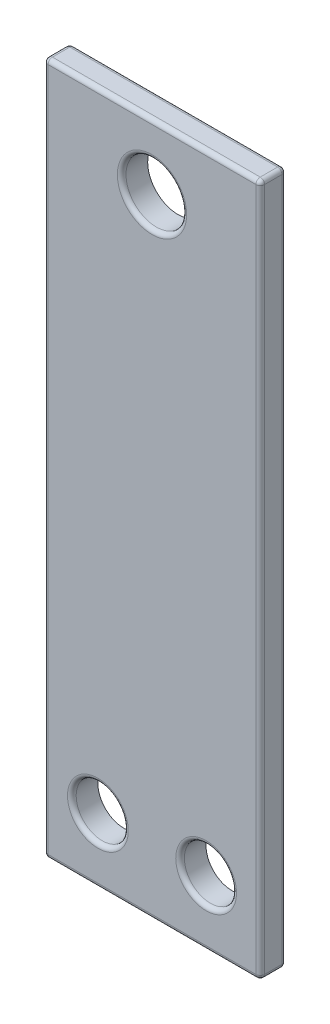
from build123d import *

# Parameters (mm, degrees)
CROQUIS1_W              = 25
CROQUIS1_H              = 80
CROQUIS1_R              = 3.5
CROQUIS1_R_2            = 3.009292022
SALIENTE_EXTRUIR1_DEPTH = 3
REDONDEO1_R             = 0.5


with BuildPart() as part:
    # Croquis1 → Saliente-Extruir1 (new body)
    with BuildSketch(Plane.XY):
        Rectangle(CROQUIS1_W, CROQUIS1_H)
        with Locations((0, 32.5)):
            Circle(CROQUIS1_R, mode=Mode.SUBTRACT)
        with Locations((6.25, -32.5)):
            Circle(CROQUIS1_R_2, mode=Mode.SUBTRACT)
        with Locations(Location((-6.25, -32.5, 0), (0, 0, 180))):
            Circle(CROQUIS1_R_2, mode=Mode.SUBTRACT)
    extrude(amount=SALIENTE_EXTRUIR1_DEPTH)

    # Redondeo1
    redondeo1_edges = [part.edges().sort_by_distance(p)[0] for p in [
        (-3.5, 32.5, 3),
        (-12.5, 0, 3),
        (3.240707978, -32.5, 3),
        (0, -40, 3),
        (-3.240707978, -32.5, 3),
        (12.5, 0, 3),
        (0, -40, 0),
        (-12.5, 0, 0),
        (0, 40, 0),
        (12.5, 0, 0),
        (12.5, -40, 1.5),
        (-12.5, -40, 1.5),
        (-12.5, 40, 1.5),
        (12.5, 40, 1.5),
        (0, 40, 3),
    ]]
    fillet(redondeo1_edges, radius=REDONDEO1_R)


solid = part.part
